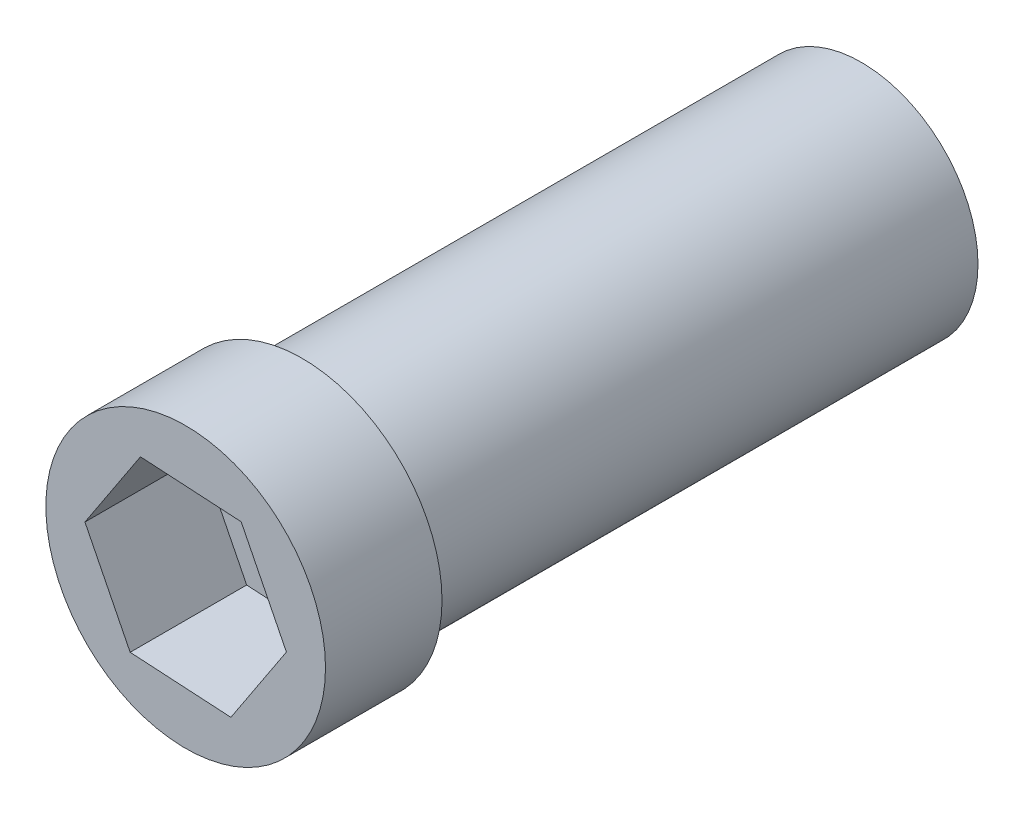
from build123d import *

# Parameters (mm, degrees)
CROQUIS1_R              = 3.175
SALIENTE_EXTRUIR1_DEPTH = 15.24
CROQUIS2_R              = 3.81
SALIENTE_EXTRUIR2_DEPTH = 3.175
CORTAR_EXTRUIR1_DEPTH   = 3.175


with BuildPart() as part:
    # Croquis1 → Saliente-Extruir1 (new body)
    with BuildSketch(Plane.XY):
        Circle(CROQUIS1_R)
    extrude(amount=-SALIENTE_EXTRUIR1_DEPTH)

    # Croquis2 → Saliente-Extruir2 (add)
    with BuildSketch(Plane.XY):
        Circle(CROQUIS2_R)
    extrude(amount=SALIENTE_EXTRUIR2_DEPTH)

    # Croquis3 → Cortar-Extruir1 (cut)
    with BuildSketch(Plane.XY.offset(3.175)):
        Polygon((-2.744859196, 0.161915851), (-1.512652839, -2.296159868), (1.232206357, -2.458075719), (2.744859196, -0.161915851), (1.512652839, 2.296159868), (-1.232206357, 2.458075719), align=None)
    extrude(amount=-CORTAR_EXTRUIR1_DEPTH, mode=Mode.SUBTRACT)


solid = part.part
